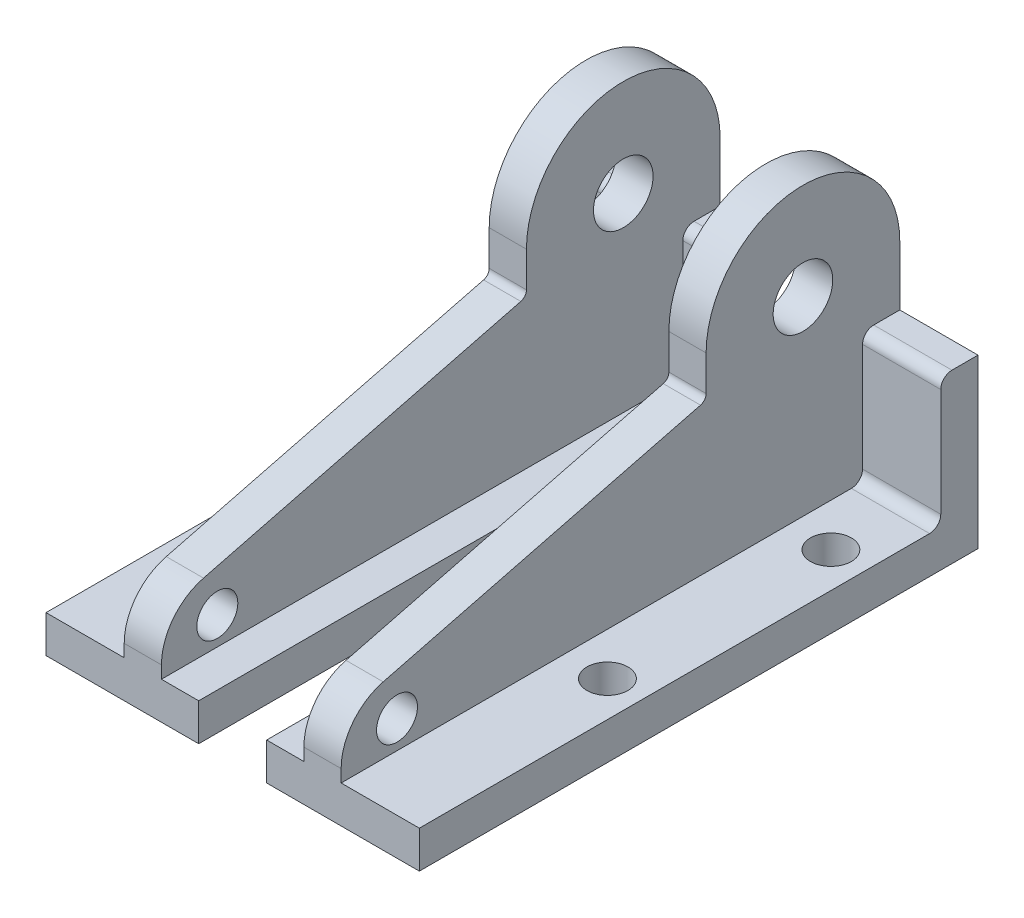
from build123d import *

# Parameters (mm, degrees)
SKETCH1_W                = 82
SKETCH1_H                = 150
BOSS_EXTRUDE1_DEPTH      = 10
SKETCH2_W                = 10
SKETCH2_H                = 45
BOSS_EXTRUDE2_DEPTH      = 82
BOSS_EXTRUDE3_DEPTH      = 42
BOSS_EXTRUDE3_DEPTH_BACK = 10
FILLET3_RADIUS           = 26
FILLET3_LENGTH           = 10
FILLET4_RADIUS           = 26
FILLET4_LENGTH           = 10
BOSS_EXTRUDE4_DEPTH      = 10
BOSS_EXTRUDE5_DEPTH      = 10
FILLET5_R                = 15
FILLET6_R                = 15
SKETCH6_R                = 8
SKETCH6_R_2              = 5.5
CUT_EXTRUDE1_DEPTH       = 131.057679512
FILLET7_R                = 3
FILLET8_R                = 3
FILLET9_R                = 3
FILLET10_R               = 3
FILLET11_R               = 2
SKETCH7_R                = 5.5
CUT_EXTRUDE2_DEPTH       = 116.043470045


with BuildPart() as part:
    # Sketch1 → Boss-Extrude1 (new body)
    with BuildSketch(Plane(origin=(0, 0, 0), x_dir=(1, 0, 0), z_dir=(0, 1, 0))):
        Rectangle(SKETCH1_W, SKETCH1_H)
    extrude(amount=BOSS_EXTRUDE1_DEPTH)

    # Sketch2 → Boss-Extrude2 (add, through all)
    with BuildSketch(Plane(origin=(41, 0, 0), x_dir=(0, 0, -1), z_dir=(1, 0, 0))):
        with Locations((70, 22.5)):
            Rectangle(SKETCH2_W, SKETCH2_H)
    extrude(amount=-BOSS_EXTRUDE2_DEPTH)

    # Sketch3 → Boss-Extrude3 (add, two sides: drawn at the far end of the back side and taken through both)
    with BuildSketch(Plane.XY.offset(-65).offset(-BOSS_EXTRUDE3_DEPTH_BACK)):
        Polygon((10, 45), (10, 10), (20, 10), (20, 45), (20, 87), (10, 87), align=None)
        Polygon((-10, 45), (-10, 87), (-20, 87), (-20, 45), (-20, 10), (-10, 10), align=None)
    extrude(amount=BOSS_EXTRUDE3_DEPTH + BOSS_EXTRUDE3_DEPTH_BACK)

    # Fillet3: full round fillet: the end face becomes a half cylinder, R = half its width
    fillet3_face = Plane((15, 87, -49), x_dir=(-1, 0, 0), z_dir=(0, 1, 0))  # on the end face: x along it, z out of the body
    fillet3_slab = fillet3_face.offset(-FILLET3_RADIUS / 2) * Box(FILLET3_LENGTH, 2 * FILLET3_RADIUS, FILLET3_RADIUS, mode=Mode.PRIVATE)  # the body's end, R deep
    fillet3_round = Plane((15, 61, -49), x_dir=(0, 1, 0), z_dir=(-1, 0, 0)) * Cylinder(FILLET3_RADIUS, FILLET3_LENGTH, mode=Mode.PRIVATE)  # its axis R under the face
    add(fillet3_slab - fillet3_round, mode=Mode.SUBTRACT)

    # Fillet4: full round fillet: the end face becomes a half cylinder, R = half its width
    fillet4_face = Plane((-15, 87, -49), x_dir=(-1, 0, 0), z_dir=(0, 1, 0))  # on the end face: x along it, z out of the body
    fillet4_slab = fillet4_face.offset(-FILLET4_RADIUS / 2) * Box(FILLET4_LENGTH, 2 * FILLET4_RADIUS, FILLET4_RADIUS, mode=Mode.PRIVATE)  # the body's end, R deep
    fillet4_round = Plane((-15, 61, -49), x_dir=(0, 1, 0), z_dir=(-1, 0, 0)) * Cylinder(FILLET4_RADIUS, FILLET4_LENGTH, mode=Mode.PRIVATE)  # its axis R under the face
    add(fillet4_slab - fillet4_round, mode=Mode.SUBTRACT)

    # Sketch4 → Boss-Extrude4 (add)
    with BuildSketch(Plane(origin=(20, 0, 0), x_dir=(0, 0, -1), z_dir=(1, 0, 0))):
        Polygon((23, 10), (23, 50), (-75, 25), (-75, 10), align=None)
    extrude(amount=-BOSS_EXTRUDE4_DEPTH)

    # Sketch5 → Boss-Extrude5 (add)
    with BuildSketch(Plane.ZY.offset(20)):
        Polygon((-23, 50), (75, 25), (75, 10), (-23, 10), align=None)
    extrude(amount=-BOSS_EXTRUDE5_DEPTH)

    # Fillet5
    fillet5_edges = [part.edges().sort_by_distance(p)[0] for p in [
        (15, 25, 75),
    ]]
    fillet(fillet5_edges, radius=FILLET5_R)

    # Fillet6
    fillet6_edges = [part.edges().sort_by_distance(p)[0] for p in [
        (-15, 25, 75),
    ]]
    fillet(fillet6_edges, radius=FILLET6_R)

    # Sketch6 → Cut-Extrude1 (cut, through all)
    with BuildSketch(Plane(origin=(20, 0, 0), x_dir=(0, 0, -1), z_dir=(1, 0, 0))):
        with Locations((49, 61)):
            Circle(SKETCH6_R)
        with Locations((-60, 17.5)):
            Circle(SKETCH6_R_2)
    extrude(amount=-CUT_EXTRUDE1_DEPTH, mode=Mode.SUBTRACT)

    # Fillet7
    fillet7_edges = [part.edges().sort_by_distance(p)[0] for p in [
        (30.5, 45, -65),
    ]]
    fillet(fillet7_edges, radius=FILLET7_R)

    # Fillet8
    fillet8_edges = [part.edges().sort_by_distance(p)[0] for p in [
        (0, 45, -65),
    ]]
    fillet(fillet8_edges, radius=FILLET8_R)

    # Fillet9
    fillet9_edges = [part.edges().sort_by_distance(p)[0] for p in [
        (-30.5, 45, -65),
    ]]
    fillet(fillet9_edges, radius=FILLET9_R)

    # Fillet10
    fillet10_edges = [part.edges().sort_by_distance(p)[0] for p in [
        (30.5, 10, -65),
        (0, 10, -65),
        (-30.5, 10, -65),
    ]]
    fillet(fillet10_edges, radius=FILLET10_R)

    # Fillet11
    fillet11_edges = [part.edges().sort_by_distance(p)[0] for p in [
        (15, 50, -23),
        (-15, 50, -23),
    ]]
    fillet(fillet11_edges, radius=FILLET11_R)

    # Sketch7 → Cut-Extrude2 (cut, through all)
    with BuildSketch(Plane(origin=(0, 10, 0), x_dir=(1, 0, 0), z_dir=(0, 1, 0))):
        with Locations(Location((31.5, 45, 0), (0, 0, 270))):
            Circle(SKETCH7_R)
        with Locations(Location((31.5, -15, 0), (0, 0, 270))):
            Circle(SKETCH7_R)
        with Locations(Location((-31.5, -15, 0), (0, 0, 90))):
            Circle(SKETCH7_R)
        with Locations(Location((-31.5, 45, 0), (0, 0, 90))):
            Circle(SKETCH7_R)
    extrude(amount=-CUT_EXTRUDE2_DEPTH, mode=Mode.SUBTRACT)


with BuildPart() as body_2:
    # Split1: the piece on the far side of the plane
    add(part.part)
    split(bisect_by=Plane(origin=(0, 0, 0), x_dir=(0, 0, 1), z_dir=(1, 0, 0)), keep=Keep.BOTTOM)


with BuildPart() as part_1:
    add(part.part)

    # Split1
    split(bisect_by=Plane(origin=(0, 0, 0), x_dir=(0, 0, 1), z_dir=(1, 0, 0)), keep=Keep.TOP)


with BuildPart() as part_2:
    # Body-Move/Copy1: moved
    add(part_1.part.moved(Location((18.244226767, 0, 0))))


solid = Compound([body_2.part, part_2.part])
